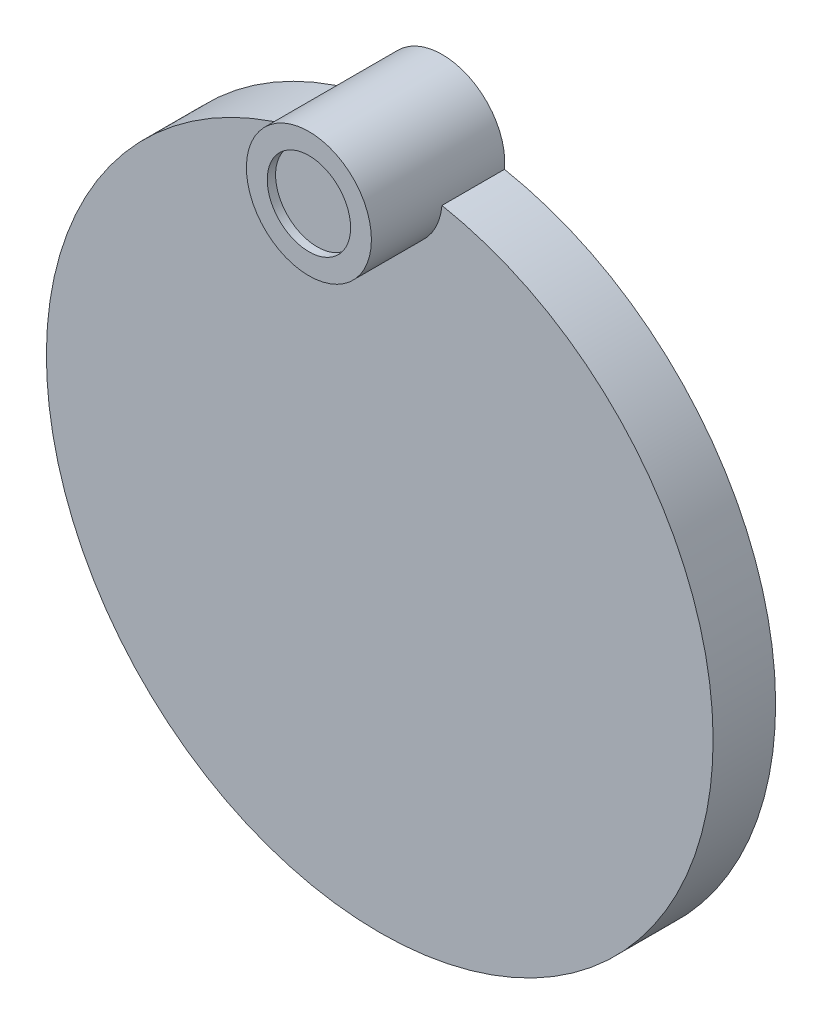
from build123d import *

# Parameters (mm, degrees)
EXTRUDE_1_DEPTH     = 15
SKETCH_5_R          = 15
EXTRUDE_3_DEPTH     = 17
SKETCH_9_R          = 10
CUT_EXTRUDE_2_DEPTH = 2


with BuildPart() as part:
    # ｽｹｯﾁ4 → ﾎﾞｽ - 押し出し1 (new body)
    with BuildSketch(Plane.XY):
        with BuildLine():
            ThreePointArc((14.933936552, -1.40625), (0, 15), (-14.933936552, -1.40625))
            ThreePointArc((-14.933936552, -1.40625), (0, -160), (14.933936552, -1.40625))
        make_face()
    extrude(amount=EXTRUDE_1_DEPTH)

    # ｽｹｯﾁ5 → ﾎﾞｽ - 押し出し3 (add)
    with BuildSketch(Plane.XY.offset(15)):
        with Locations(Location((0, 0, 0), (0, 0, 185.379378991))):
            Circle(SKETCH_5_R)
    extrude(amount=EXTRUDE_3_DEPTH)

    # ｽｹｯﾁ9 → ｶｯﾄ - 押し出し2 (cut)
    with BuildSketch(Plane.XY.offset(32)):
        Circle(SKETCH_9_R)
    extrude(amount=-CUT_EXTRUDE_2_DEPTH, mode=Mode.SUBTRACT)


solid = part.part
